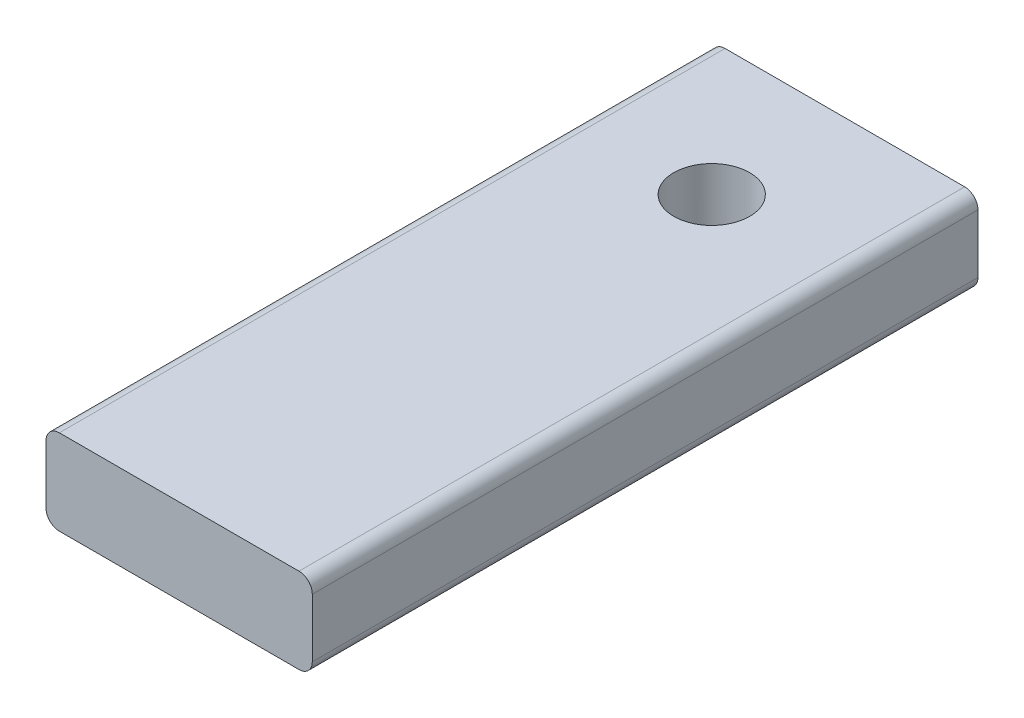
from build123d import *

# Parameters (mm, degrees)
BOSS_EXTRUDE1_DEPTH = 50
SKETCH2_R           = 2.85
CUT_EXTRUDE1_DEPTH  = 8


with BuildPart() as part:
    # Sketch1 → Boss-Extrude1 (new body)
    with BuildSketch(Plane.XY):
        with BuildLine():
            Line((-9, -3.2), (9, -3.2))
            ThreePointArc((9, -3.2), (9.707106781, -2.907106781), (10, -2.2))
            Line((10, -2.2), (10, 2.2))
            ThreePointArc((10, 2.2), (9.707106781, 2.907106781), (9, 3.2))
            Line((9, 3.2), (-9, 3.2))
            ThreePointArc((-9, 3.2), (-9.707106781, 2.907106781), (-10, 2.2))
            Line((-10, 2.2), (-10, -2.2))
            ThreePointArc((-10, -2.2), (-9.707106781, -2.907106781), (-9, -3.2))
        make_face()
    extrude(amount=BOSS_EXTRUDE1_DEPTH)

    # Sketch2 → Cut-Extrude1 (cut)
    with BuildSketch(Plane(origin=(0, -4, 0), x_dir=(1, 0, 0), z_dir=(0, 1, 0))):
        with Locations(Location((0, -10, 0), (0, 0, 90))):
            Circle(SKETCH2_R)
    extrude(amount=CUT_EXTRUDE1_DEPTH, mode=Mode.SUBTRACT)


solid = part.part
